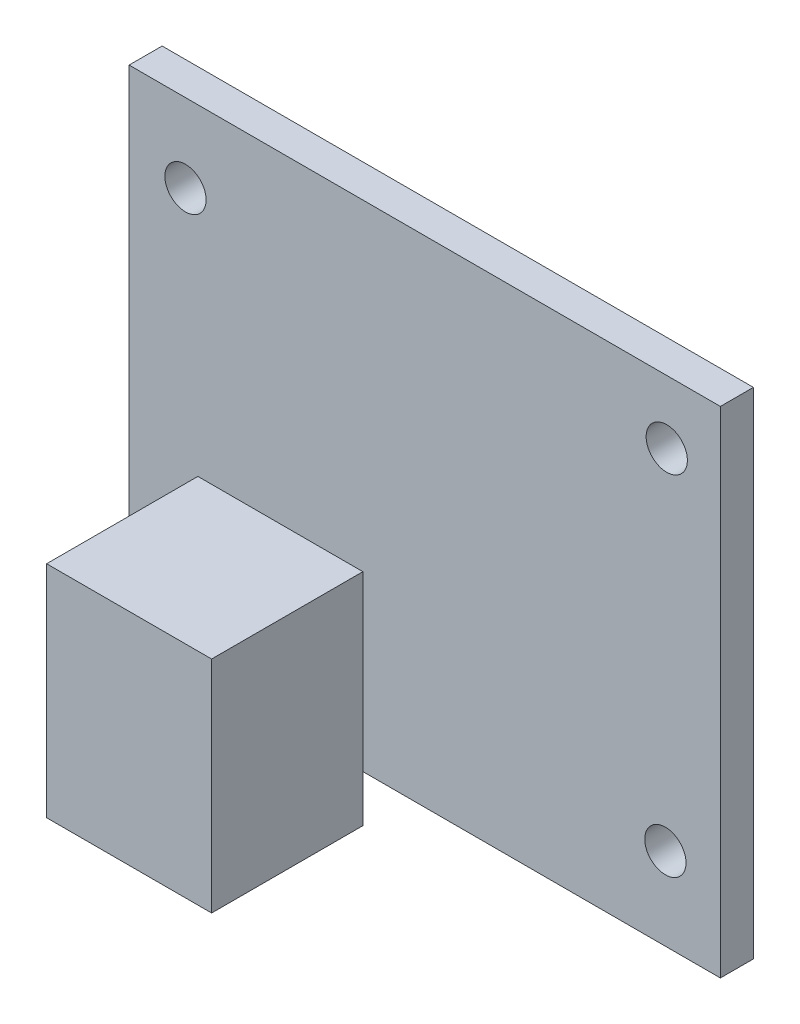
from build123d import *

# Parameters (mm, degrees)
SKETCH1_W           = 43
SKETCH1_H           = 36
SKETCH1_R           = 1.5
BOSS_EXTRUDE1_DEPTH = 2.4
SKETCH2_W           = 12
SKETCH2_H           = 16
BOSS_EXTRUDE2_DEPTH = 11


with BuildPart() as part:
    # Sketch1 → Boss-Extrude1 (new body)
    with BuildSketch(Plane.XY):
        with Locations((21.5, 18)):
            Rectangle(SKETCH1_W, SKETCH1_H)
        with Locations((39, 6)):
            Circle(SKETCH1_R, mode=Mode.SUBTRACT)
        with Locations((4.1, 30.3)):
            Circle(SKETCH1_R, mode=Mode.SUBTRACT)
        with Locations((39.1, 31.4)):
            Circle(SKETCH1_R, mode=Mode.SUBTRACT)
    extrude(amount=BOSS_EXTRUDE1_DEPTH)

    # Sketch2 → Boss-Extrude2 (add)
    with BuildSketch(Plane.XY.offset(2.4)):
        with Locations((11, 4.591861043)):
            Rectangle(SKETCH2_W, SKETCH2_H)
    extrude(amount=BOSS_EXTRUDE2_DEPTH)


solid = part.part
